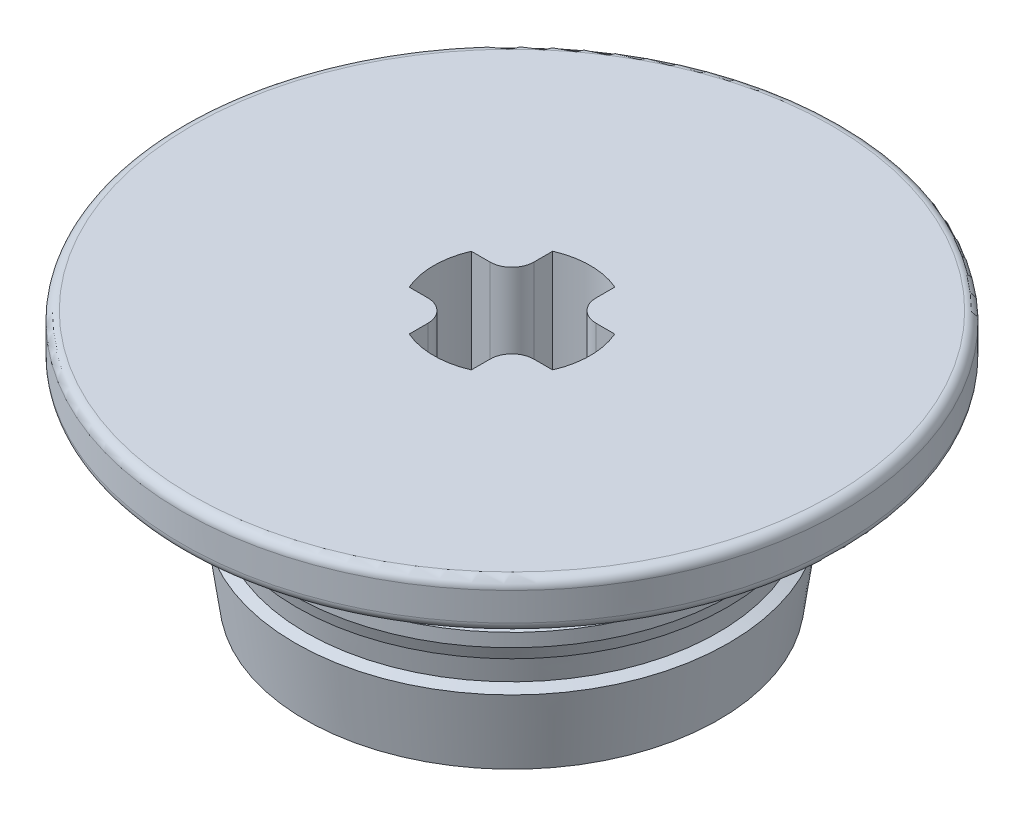
from build123d import *

# Parameters (mm, degrees)
CUT_EXTRUDE1_DEPTH = 17.867127793
FILLET1_R          = 0.7
FILLET2_R          = 0.3


with BuildPart() as part:
    # Sketch2 → Revolve1 (revolve)
    with BuildSketch(Plane.XY, mode=Mode.PRIVATE) as revolve1_sk:
        Polygon((0, 0), (10.5, 0), (10.5, -1.5), (7.5, -1.5), (7.291240349, -2.985402103), (6.942652064, -2.936411215), (6.803478963, -3.926679283), (6.972213603, -3.950393391), (6.972213603, -4.374297025), (6.861946509, -4.75677404), (6.690208868, -4.732637888), (6.568289136, -5.600141858), (6.906531053, -5.722750977), (6.586484574, -8), (0, -8), align=None)
    revolve(revolve1_sk.sketch.rotate(Axis((0, 0, 0), (0, 1, 0)), 90), axis=Axis((0, 0, 0), (0, 1, 0)))

    # Sketch1 → Cut-Extrude1 (cut, through all)
    with BuildSketch(Plane(origin=(0, 0, 0), x_dir=(1, 0, 0), z_dir=(0, 1, 0))):
        with BuildLine():
            Line((-0.99, 0.99), (-2.284731932, 0.99))
            ThreePointArc((-2.284731932, 0.99), (-2.49, 0), (-2.284731932, -0.99))
            Line((-2.284731932, -0.99), (-0.99, -0.99))
            Line((-0.99, -0.99), (-0.99, -2.284731932))
            ThreePointArc((-0.99, -2.284731932), (0, -2.49), (0.99, -2.284731932))
            Line((0.99, -2.284731932), (0.99, -0.99))
            Line((0.99, -0.99), (2.284249826, -0.99))
            ThreePointArc((2.284249826, -0.99), (2.489557645, 0), (2.284249826, 0.99))
            Line((2.284249826, 0.99), (0.99, 0.99))
            Line((0.99, 0.99), (0.99, 2.28753254))
            ThreePointArc((0.99, 2.28753254), (0, 2.492569984), (-0.99, 2.28753254))
            Line((-0.99, 2.28753254), (-0.99, 0.99))
        make_face()
    extrude(amount=-CUT_EXTRUDE1_DEPTH, mode=Mode.SUBTRACT)

    # Fillet1
    fillet1_edges = [part.edges().sort_by_distance(p)[0] for p in [
        (-0.99, -4, -0.99),
        (0.99, -4, -0.99),
        (0.99, -4, 0.99),
        (-0.99, -4, 0.99),
    ]]
    fillet(fillet1_edges, radius=FILLET1_R)

    # Fillet2
    fillet2_edges = [part.edges().sort_by_distance(p)[0] for p in [
        (0, -1.5, 7.5),
        (0, -1.5, 10.5),
        (0, 0, 10.5),
    ]]
    fillet(fillet2_edges, radius=FILLET2_R)


solid = part.part
